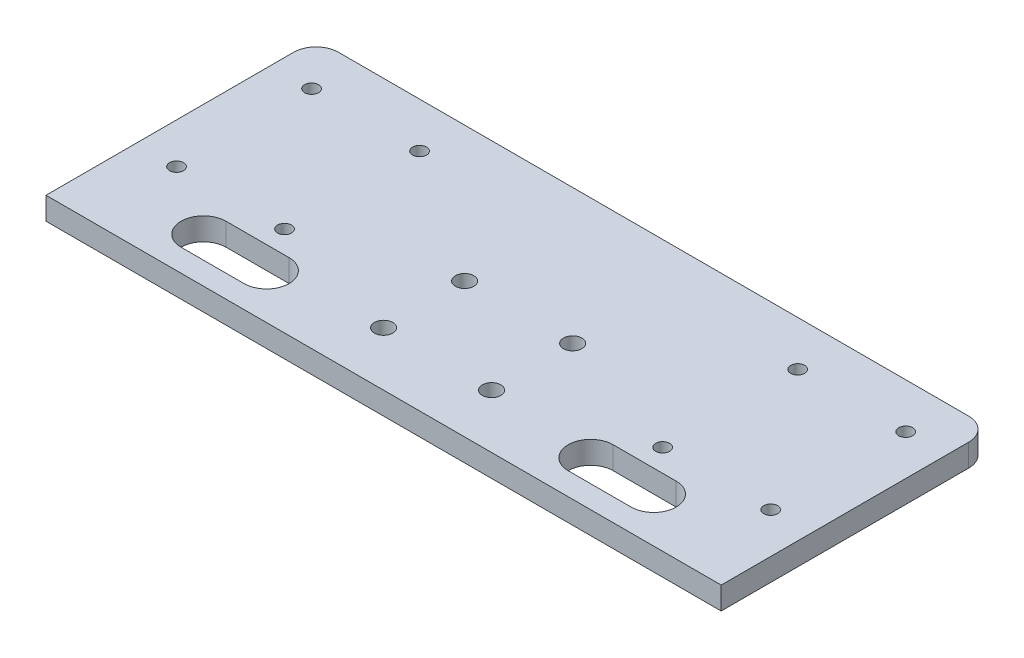
from build123d import *

# Parameters (mm, degrees)
SKETCH_1_W          = 150
SKETCH_1_H          = 60
EXTRUDE_1_DEPTH     = 5
SKETCH_2_R          = 1.55
CUT_EXTRUDE_1_DEPTH = 10
SKETCH_3_R          = 2.05
CUT_EXTRUDE_2_DEPTH = 81.932070281
FILLET_1_R          = 5
CUT_EXTRUDE_3_DEPTH = 10


with BuildPart() as part:
    # 草图1 → 凸台-拉伸1 (new body)
    with BuildSketch(Plane(origin=(0, 0, 0), x_dir=(1, 0, 0), z_dir=(0, 1, 0))):
        Rectangle(SKETCH_1_W, SKETCH_1_H)
    extrude(amount=EXTRUDE_1_DEPTH)

    # 草图2 → 切除-拉伸1 (cut)
    with BuildSketch(Plane(origin=(0, 0, 0), x_dir=(-1, 0, 0), z_dir=(0, -1, 0))):
        with Locations(Location((-66, 20, 0), (0, 0, 90))):
            Circle(SKETCH_2_R)
        with Locations(Location((-42, 20, 0), (0, 0, 90))):
            Circle(SKETCH_2_R)
        with Locations(Location((-66, -10, 0), (0, 0, 90))):
            Circle(SKETCH_2_R)
        with Locations(Location((-42, -10, 0), (0, 0, 90))):
            Circle(SKETCH_2_R)
        with Locations(Location((42, 20, 0), (0, 0, 90))):
            Circle(SKETCH_2_R)
        with Locations(Location((66, 20, 0), (0, 0, 90))):
            Circle(SKETCH_2_R)
        with Locations(Location((42, -10, 0), (0, 0, 90))):
            Circle(SKETCH_2_R)
        with Locations(Location((66, -10, 0), (0, 0, 90))):
            Circle(SKETCH_2_R)
    extrude(amount=-CUT_EXTRUDE_1_DEPTH, mode=Mode.SUBTRACT)

    # 草图3 → 切除-拉伸2 (cut, through all)
    with BuildSketch(Plane(origin=(0, 5, 0), x_dir=(1, 0, 0), z_dir=(0, 1, 0))):
        with Locations(Location((-12, 0, 0), (0, 0, 270))):
            Circle(SKETCH_3_R)
        with Locations(Location((12, 0, 0), (0, 0, 270))):
            Circle(SKETCH_3_R)
        with Locations(Location((-12, -18, 0), (0, 0, 270))):
            Circle(SKETCH_3_R)
        with Locations(Location((12, -18, 0), (0, 0, 270))):
            Circle(SKETCH_3_R)
    extrude(amount=-CUT_EXTRUDE_2_DEPTH, mode=Mode.SUBTRACT)

    # 圆角1
    fillet_1_edges = [part.edges().sort_by_distance(p)[0] for p in [
        (-75, 2.5, -30),
        (75, 2.5, -30),
    ]]
    fillet(fillet_1_edges, radius=FILLET_1_R)

    # 草图4 → 切除-拉伸3 (cut)
    with BuildSketch(Plane(origin=(0, 5, 0), x_dir=(1, 0, 0), z_dir=(0, 1, 0))):
        with BuildLine():
            Line((-50, -15), (-36, -15))
            ThreePointArc((-36, -15), (-31, -20), (-36, -25))
            Line((-36, -25), (-50, -25))
            ThreePointArc((-50, -25), (-55, -20), (-50, -15))
        make_face()
        with BuildLine():
            Line((50, -15), (36, -15))
            ThreePointArc((36, -15), (31, -20), (36, -25))
            Line((36, -25), (50, -25))
            ThreePointArc((50, -25), (55, -20), (50, -15))
        make_face()
    extrude(amount=-CUT_EXTRUDE_3_DEPTH, mode=Mode.SUBTRACT)


solid = part.part
